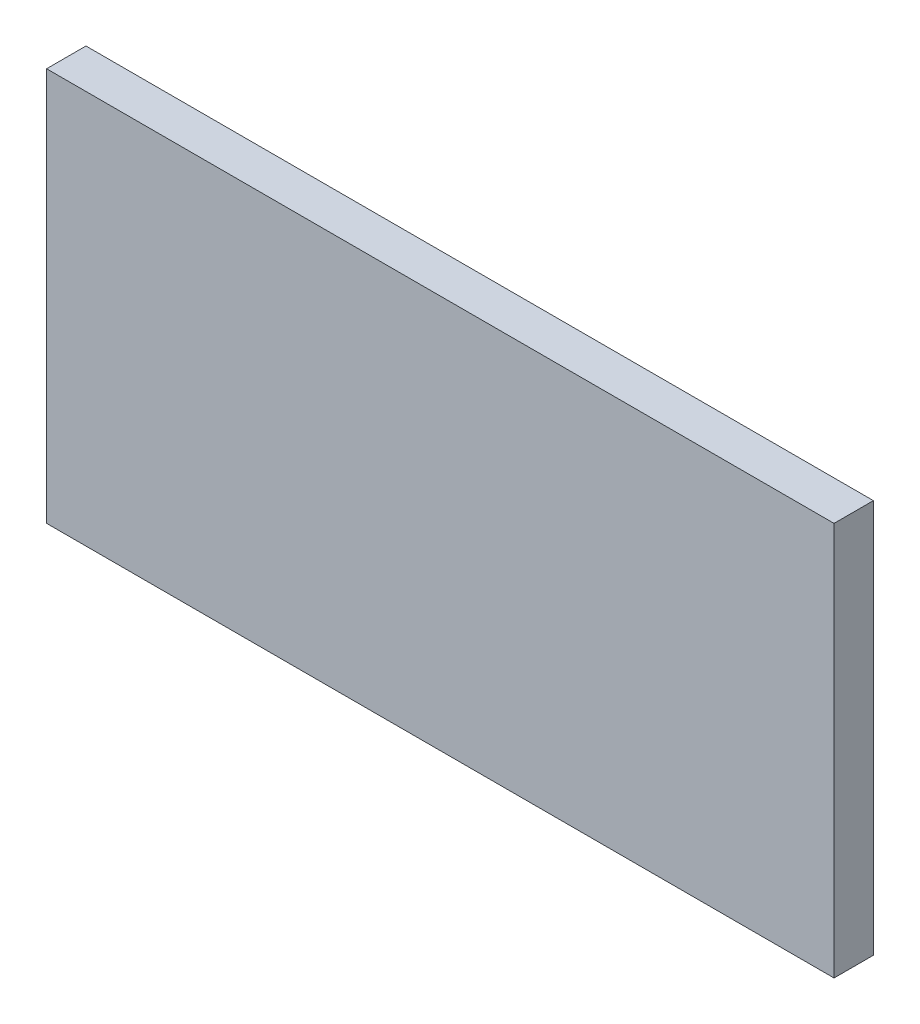
from build123d import *

# Parameters (mm, degrees)
SKETCH1_W           = 25.4
SKETCH1_H           = 12.7
BOSS_EXTRUDE1_DEPTH = 1.27


with BuildPart() as part:
    # Sketch1 → Boss-Extrude1 (new body)
    with BuildSketch(Plane.XY):
        Rectangle(SKETCH1_W, SKETCH1_H)
    extrude(amount=BOSS_EXTRUDE1_DEPTH)


solid = part.part
